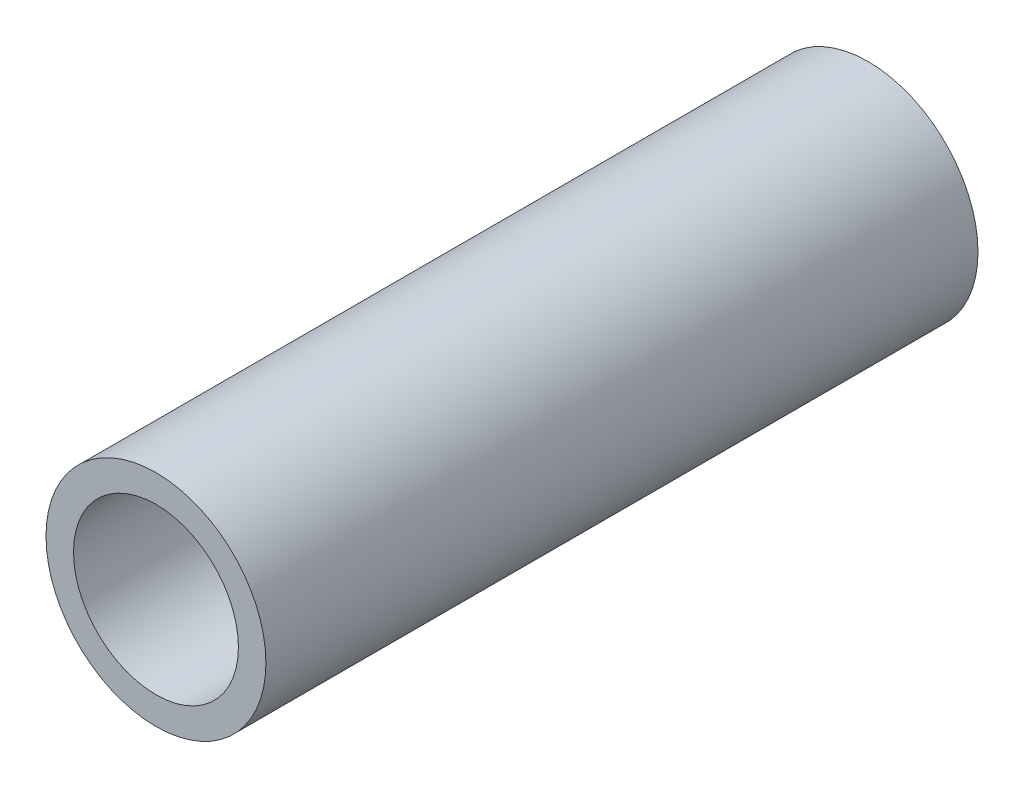
from build123d import *

# Parameters (mm, degrees)
SKETCH1_R           = 4.2
SKETCH1_R_2         = 3.15
BOSS_EXTRUDE1_DEPTH = 27.2


with BuildPart() as part:
    # Sketch1 → Boss-Extrude1 (new body)
    with BuildSketch(Plane.XY):
        Circle(SKETCH1_R)
        Circle(SKETCH1_R_2, mode=Mode.SUBTRACT)
    extrude(amount=BOSS_EXTRUDE1_DEPTH)


solid = part.part
